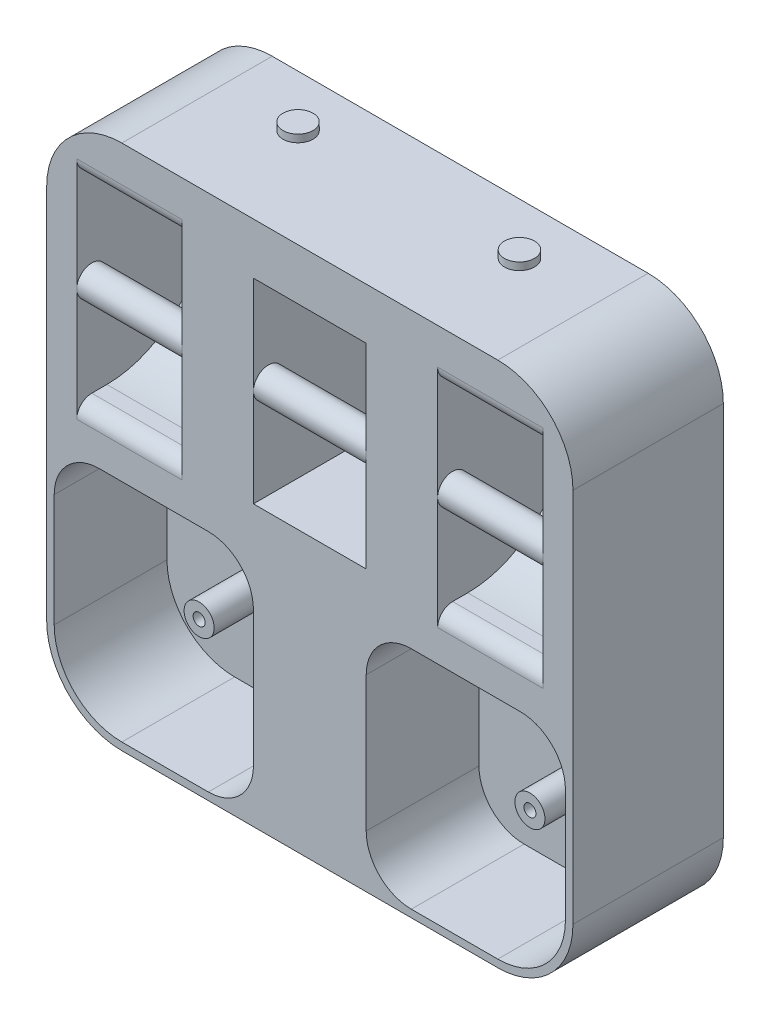
from build123d import *

# Parameters (mm, degrees)
SKETCH_1_W          = 350
SKETCH_1_H          = 350
EXTRUDE_1_DEPTH     = 100
FILLET_1_R          = 50
CUT_EXTRUDE_1_DEPTH = 35
SKETCH_4_W          = 75
SKETCH_4_H          = 130
CUT_EXTRUDE_2_DEPTH = 75
EXTRUDE_3_REACH     = 388.685
SKETCH_5_R          = 10
FILLET_2_R          = 10
CUT_EXTRUDE_3_DEPTH = 75
SKETCH_7_R          = 10
SKETCH_7_R_2        = 4
EXTRUDE_4_DEPTH     = 38.62
SKETCH_8_W          = 75
SKETCH_8_H          = 150
EXTRUDE_5_DEPTH     = 75
FILLET_3_R          = 30
SKETCH_9_R          = 10
EXTRUDE_6_DEPTH     = 5


with BuildPart() as part:
    # 草图1 → 凸台-拉伸1 (new body)
    with BuildSketch(Plane.XY):
        Rectangle(SKETCH_1_W, SKETCH_1_H)
    extrude(amount=EXTRUDE_1_DEPTH)

    # 圆角1
    fillet_1_edges = [part.edges().sort_by_distance(p)[0] for p in [
        (-175, 175, 50),
        (175, 175, 50),
        (175, -175, 50),
        (-175, -175, 50),
    ]]
    fillet(fillet_1_edges, radius=FILLET_1_R)

    # 草图3 → 切除-拉伸1 (cut, symmetric)
    with BuildSketch(Plane.ZY.offset(120)):
        with BuildLine():
            Line((15, 75.934955472), (100, 75.934955472))
            Line((100, 75.934955472), (100, 140.934955472))
            Line((100, 140.934955472), (80, 140.934955472))
            ThreePointArc((80, 140.934955472), (34.038059223, 121.896896249), (15, 75.934955472))
        make_face()
        with BuildLine():
            Line((100, 10.934955472), (100, 75.934955472))
            Line((100, 75.934955472), (15, 75.934955472))
            ThreePointArc((15, 75.934955472), (34.038059223, 29.973014695), (80, 10.934955472))
            Line((80, 10.934955472), (100, 10.934955472))
        make_face()
    cut_extrude_1 = extrude(amount=CUT_EXTRUDE_1_DEPTH, both=True, mode=Mode.SUBTRACT)

    # 镜向1: 切除-拉伸1 across plane
    add(cut_extrude_1.mirror(Plane(origin=(0, 0, 0), x_dir=(0, 0, 1), z_dir=(1, 0, 0))), mode=Mode.SUBTRACT)

    # 草图4 → 切除-拉伸2 (cut)
    with BuildSketch(Plane.XY.offset(100)):
        with Locations((0, 75.934955472)):
            Rectangle(SKETCH_4_W, SKETCH_4_H)
    extrude(amount=-CUT_EXTRUDE_2_DEPTH, mode=Mode.SUBTRACT)

    # 凸台-拉伸3: up to this face of the body (flat: up to its plane)
    extrude_3_end = Plane(part.part.faces().sort_by_distance((155, 75.934955472, 62.993408065))[0])
    # 草图5 → 凸台-拉伸3 (add, up to the picked face)
    with BuildSketch(Plane(origin=(-155, 0, 0), x_dir=(0, 0, -1), z_dir=(1, 0, 0)), mode=Mode.PRIVATE) as extrude_3_sk1:
        with Locations(Location((-90, 75.934955472, 0), (0, 0, 180))):
            Circle(SKETCH_5_R)
    extrude_3_tool1 = split(extrude(extrude_3_sk1.sketch, amount=EXTRUDE_3_REACH, mode=Mode.PRIVATE), bisect_by=extrude_3_end, keep=Keep.BOTH, mode=Mode.PRIVATE)
    add(extrude_3_tool1.solids().sort_by(Axis((-155, 75.934955, 90), (1, 0, 0)))[0])

    # 圆角2
    fillet_2_edges = [part.edges().sort_by_distance(p)[0] for p in [
        (-120, 10.934955472, 100),
        (-120, 140.934955472, 100),
        (120, 140.934955472, 100),
        (120, 10.934955472, 100),
    ]]
    fillet(fillet_2_edges, radius=FILLET_2_R)

    # 草图6 → 切除-拉伸3 (cut)
    with BuildSketch(Plane.XY.offset(100)):
        with BuildLine():
            Line((170, -20), (0, -20))
            Line((0, -20), (0, -170))
            Line((0, -170), (125, -170))
            ThreePointArc((125, -170), (156.819805153, -156.819805153), (170, -125))
            Line((170, -125), (170, -20))
        make_face()
        with BuildLine():
            Line((0, -170), (0, -20))
            Line((0, -20), (-170, -20))
            Line((-170, -20), (-170, -125))
            ThreePointArc((-170, -125), (-156.819805153, -156.819805153), (-125, -170))
            Line((-125, -170), (0, -170))
        make_face()
    extrude(amount=-CUT_EXTRUDE_3_DEPTH, mode=Mode.SUBTRACT)

    # 草图7 → 凸台-拉伸4 (add)
    # profile 1 of 2: a face of its own
    with BuildSketch(Plane.XY.offset(25)):
        with Locations(Location((110, -110, 0), (0, 0, 180))):
            Circle(SKETCH_7_R)
        with Locations(Location((110, -110, 0), (0, 0, 180))):
            Circle(SKETCH_7_R_2, mode=Mode.SUBTRACT)
    # profile 2 of 2: a face of its own
    with BuildSketch(Plane.XY.offset(25)):
        with Locations(Location((-110, -110, 0), (0, 0, 180))):
            Circle(SKETCH_7_R)
        with Locations(Location((-110, -110, 0), (0, 0, 180))):
            Circle(SKETCH_7_R_2, mode=Mode.SUBTRACT)
    extrude(amount=EXTRUDE_4_DEPTH)

    # 草图8 → 凸台-拉伸5 (add)
    with BuildSketch(Plane.XY.offset(25)):
        with Locations((0, -95)):
            Rectangle(SKETCH_8_W, SKETCH_8_H)
    extrude(amount=EXTRUDE_5_DEPTH)

    # 圆角3
    fillet_3_edges = [part.edges().sort_by_distance(p)[0] for p in [
        (-170, -20, 62.5),
        (170, -20, 62.5),
        (-37.5, -170, 62.5),
        (37.5, -170, 62.5),
        (37.5, -20, 62.5),
        (-37.5, -20, 62.5),
    ]]
    fillet(fillet_3_edges, radius=FILLET_3_R)

    # 草图9 → 凸台-拉伸6 (add)
    with BuildSketch(Plane(origin=(0, 175, 0), x_dir=(1, 0, 0), z_dir=(0, 1, 0))):
        with Locations((-73.626122366, -34.222973779)):
            Circle(SKETCH_9_R)
        with Locations((73.626122366, -34.222973779)):
            Circle(SKETCH_9_R)
    extrude(amount=EXTRUDE_6_DEPTH)


solid = part.part
